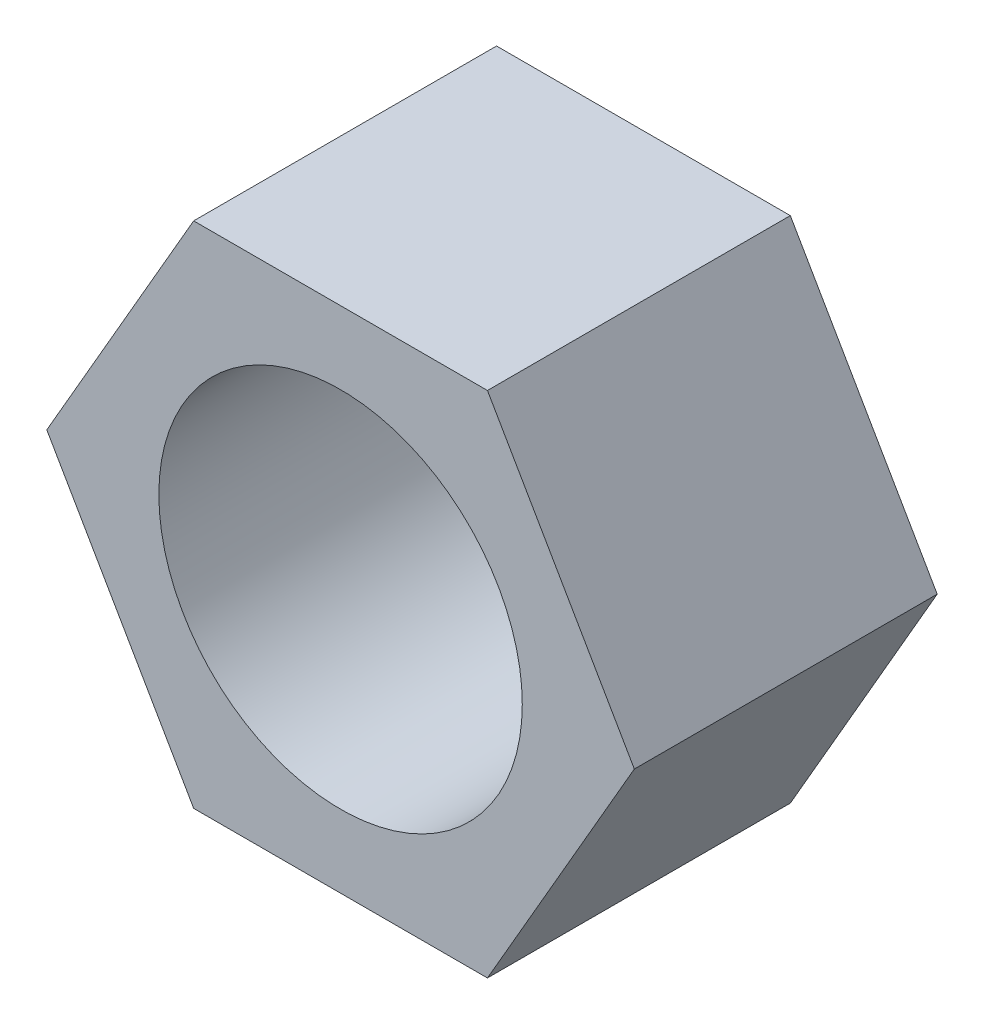
from build123d import *

# Parameters (mm, degrees)
SKETCH1_R           = 1.5
BOSS_EXTRUDE1_DEPTH = 2.5


with BuildPart() as part:
    # Sketch1 → Boss-Extrude1 (new body)
    with BuildSketch(Plane.XY):
        Polygon((19.189213506, 11.611622239), (17.976777941, 13.711622239), (15.55190681, 13.711622239), (14.339471245, 11.611622239), (15.55190681, 9.511622239), (17.976777941, 9.511622239), align=None)
        with Locations((16.764342376, 11.611622239)):
            Circle(SKETCH1_R, mode=Mode.SUBTRACT)
    extrude(amount=BOSS_EXTRUDE1_DEPTH)


solid = part.part
